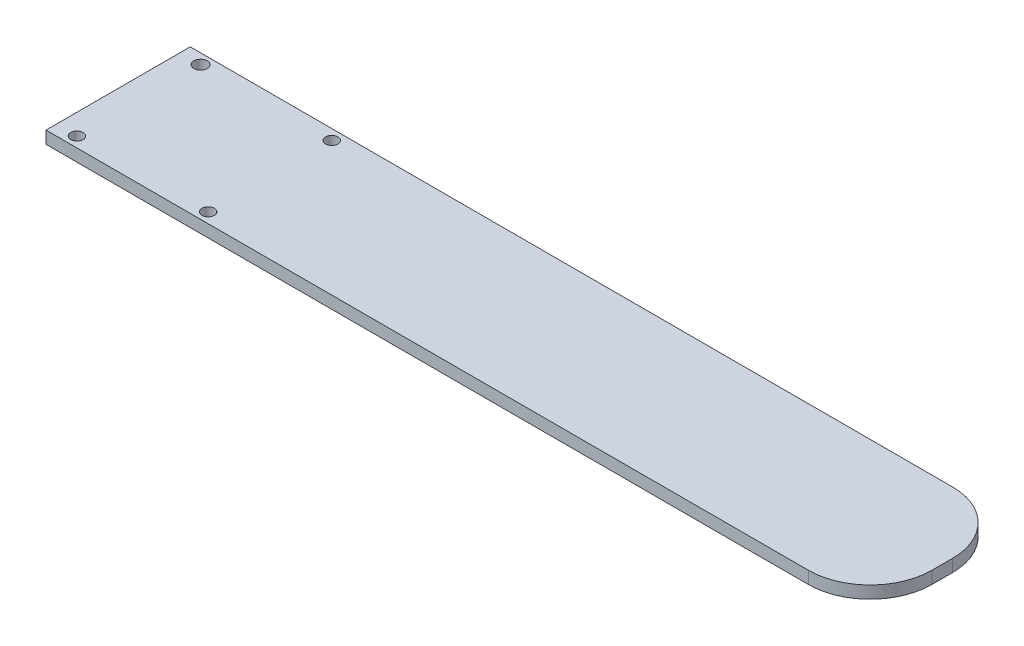
from build123d import *

# Parameters (mm, degrees)
SKETCH1_W           = 200
SKETCH1_H           = 35
BOSS_EXTRUDE1_DEPTH = 3
FILLET1_R           = 15
CUT_EXTRUDE1_DEPTH  = 102.564019219


with BuildPart() as part:
    # Sketch1 → Boss-Extrude1 (new body)
    with BuildSketch(Plane(origin=(0, 0, 0), x_dir=(1, 0, 0), z_dir=(0, 1, 0))):
        Rectangle(SKETCH1_W, SKETCH1_H)
    extrude(amount=BOSS_EXTRUDE1_DEPTH)

    # Fillet1
    fillet1_edges = [part.edges().sort_by_distance(p)[0] for p in [
        (100, 1.5, -17.5),
        (100, 1.5, 17.5),
    ]]
    fillet(fillet1_edges, radius=FILLET1_R)

    # Sketch2 → Cut-Extrude1 (cut, through all)
    with BuildSketch(Plane(origin=(0, 3, 0), x_dir=(1, 0, 0), z_dir=(0, 1, 0))):
        with BuildLine():
            ThreePointArc((-93.377001476, 15), (-96.147633262, 16.147633262), (-95, 13.377001476))
            Line((-95, 13.377001476), (-95, 15))
            Line((-95, 15), (-93.377001476, 15))
        make_face()
        with BuildLine():
            Line((-95, 15), (-95, 13.377001476))
            ThreePointArc((-95, 13.377001476), (-93.852366738, 13.852366738), (-93.377001476, 15))
            Line((-93.377001476, 15), (-95, 15))
        make_face()
        with BuildLine():
            ThreePointArc((-95, -13.5), (-96.060660172, -16.060660172), (-93.5, -15))
            Line((-93.5, -15), (-95, -15))
            Line((-95, -15), (-95, -13.5))
        make_face()
        with BuildLine():
            Line((-95, -15), (-93.5, -15))
            ThreePointArc((-93.5, -15), (-93.939339828, -13.939339828), (-95, -13.5))
            Line((-95, -13.5), (-95, -15))
        make_face()
        with BuildLine():
            ThreePointArc((-63.143993753, -13.5), (-64.204653925, -13.939339828), (-64.643993753, -15))
            Line((-64.643993753, -15), (-63.143993753, -15))
            Line((-63.143993753, -15), (-63.143993753, -13.5))
        make_face()
        with BuildLine():
            Line((-63.143993753, -15), (-64.643993753, -15))
            ThreePointArc((-64.643993753, -15), (-63.143993753, -16.5), (-61.643993753, -15))
            ThreePointArc((-61.643993753, -15), (-62.083333581, -13.939339828), (-63.143993753, -13.5))
            Line((-63.143993753, -13.5), (-63.143993753, -15))
        make_face()
        with BuildLine():
            ThreePointArc((-64.643993753, 15), (-64.204653925, 13.939339828), (-63.143993753, 13.5))
            Line((-63.143993753, 13.5), (-63.143993753, 15))
            Line((-63.143993753, 15), (-64.643993753, 15))
        make_face()
        with BuildLine():
            Line((-63.143993753, 15), (-63.143993753, 13.5))
            ThreePointArc((-63.143993753, 13.5), (-62.083333581, 13.939339828), (-61.643993753, 15))
            ThreePointArc((-61.643993753, 15), (-63.143993753, 16.5), (-64.643993753, 15))
            Line((-64.643993753, 15), (-63.143993753, 15))
        make_face()
    extrude(amount=-CUT_EXTRUDE1_DEPTH, mode=Mode.SUBTRACT)


solid = part.part
